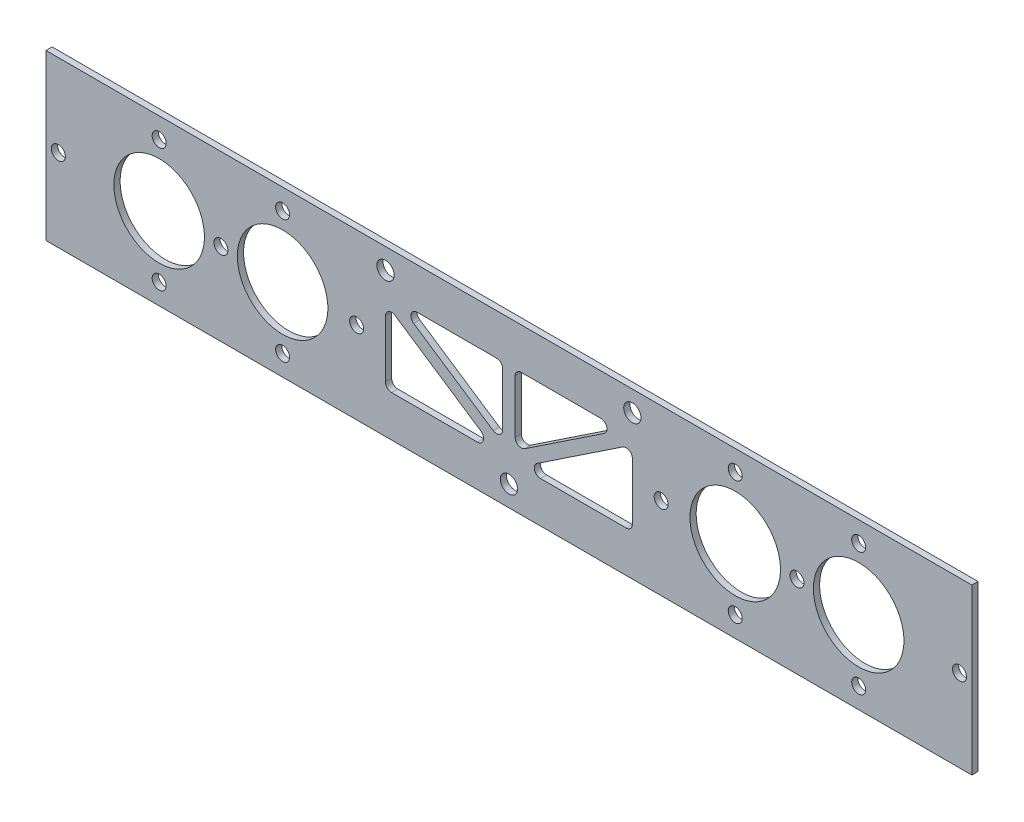
from build123d import *

# Parameters (mm, degrees)
SKETCH_1_W          = 225
SKETCH_1_H          = 40
EXTRUDE_1_DEPTH     = 1.5
SKETCH_2_R          = 11
SKETCH_2_R_2        = 2.1
CUT_EXTRUDE_1_DEPTH = 115.273794021
SKETCH_3_R          = 11
SKETCH_3_R_2        = 2.1
SKETCH_3_R_3        = 1.7
CUT_EXTRUDE_2_DEPTH = 115.273794021


with BuildPart() as part:
    # 草图1 → 凸台-拉伸1 (new body)
    with BuildSketch(Plane.XY):
        Rectangle(SKETCH_1_W, SKETCH_1_H)
    extrude(amount=EXTRUDE_1_DEPTH)

    # 草图2 → 切除-拉伸1 (cut, through all)
    with BuildSketch(Plane(origin=(0, 0, 0), x_dir=(-1, 0, 0), z_dir=(0, 0, -1))):
        with Locations((85, 0)):
            Circle(SKETCH_2_R)
        with Locations((55, 0)):
            Circle(SKETCH_2_R)
        with Locations((30, 15)):
            Circle(SKETCH_2_R_2)
        with Locations((0, -15)):
            Circle(SKETCH_2_R_2)
        with Locations((-30, 15)):
            Circle(SKETCH_2_R_2)
        with Locations((-85, 0)):
            Circle(SKETCH_2_R)
        with Locations((-55, 0)):
            Circle(SKETCH_2_R)
        with BuildLine():
            Line((-6.826276619, -7.251924558), (-27.667949706, 6.642524166))
            ThreePointArc((-27.667949706, 6.642524166), (-29.207786888, 6.716960623), (-30, 5.394448725))
            Line((-30, 5.394448725), (-30, -8.5))
            ThreePointArc((-30, -8.5), (-29.560660172, -9.560660172), (-28.5, -10))
            Line((-28.5, -10), (-7.658326913, -10))
            ThreePointArc((-7.658326913, -10), (-6.222688873, -8.934676223), (-6.826276619, -7.251924558))
        make_face()
        with BuildLine():
            Line((-1.5, -4.394448725), (-1.5, 8.5))
            ThreePointArc((-1.5, 8.5), (-1.939339828, 9.560660172), (-3, 10))
            Line((-3, 10), (-22.341673087, 10))
            ThreePointArc((-22.341673087, 10), (-23.777311127, 8.934676223), (-23.173723381, 7.251924558))
            Line((-23.173723381, 7.251924558), (-3.832050294, -5.642524166))
            ThreePointArc((-3.832050294, -5.642524166), (-2.292213112, -5.716960623), (-1.5, -4.394448725))
        make_face()
        with BuildLine():
            Line((3.832050294, -5.642524166), (23.173723381, 7.251924558))
            ThreePointArc((23.173723381, 7.251924558), (23.777311127, 8.934676223), (22.341673087, 10))
            Line((22.341673087, 10), (3, 10))
            ThreePointArc((3, 10), (1.939339828, 9.560660172), (1.5, 8.5))
            Line((1.5, 8.5), (1.5, -4.394448725))
            ThreePointArc((1.5, -4.394448725), (2.292213112, -5.716960623), (3.832050294, -5.642524166))
        make_face()
        with BuildLine():
            Line((30, -8.5), (30, 5.394448725))
            ThreePointArc((30, 5.394448725), (29.207786888, 6.716960623), (27.667949706, 6.642524166))
            Line((27.667949706, 6.642524166), (6.826276619, -7.251924558))
            ThreePointArc((6.826276619, -7.251924558), (6.222688873, -8.934676223), (7.658326913, -10))
            Line((7.658326913, -10), (28.5, -10))
            ThreePointArc((28.5, -10), (29.560660172, -9.560660172), (30, -8.5))
        make_face()
    extrude(amount=-CUT_EXTRUDE_1_DEPTH, mode=Mode.SUBTRACT)

    # 草图3 → 切除-拉伸2 (cut, through all)
    with BuildSketch(Plane(origin=(0, 0, 0), x_dir=(-1, 0, 0), z_dir=(0, 0, -1))):
        with Locations((85, 0)):
            Circle(SKETCH_3_R)
        with Locations((55, 0)):
            Circle(SKETCH_3_R)
        with Locations((0, -15)):
            Circle(SKETCH_3_R_2)
        with Locations((-55, 0)):
            Circle(SKETCH_3_R)
        with Locations((30, 15)):
            Circle(SKETCH_3_R_2)
        with Locations((-30, 15)):
            Circle(SKETCH_3_R_2)
        with Locations((-85, 0)):
            Circle(SKETCH_3_R)
        with Locations((55, -15)):
            Circle(SKETCH_3_R_3)
        with Locations((85, -15)):
            Circle(SKETCH_3_R_3)
        with Locations((-37, 0)):
            Circle(SKETCH_3_R_3)
        with Locations((37, 0)):
            Circle(SKETCH_3_R_3)
        with Locations((70, 0)):
            Circle(SKETCH_3_R_3)
        with Locations((-109.5, 0)):
            Circle(SKETCH_3_R_3)
        with Locations((-85, -15)):
            Circle(SKETCH_3_R_3)
        with Locations((109.5, 0)):
            Circle(SKETCH_3_R_3)
        with Locations((-70, 0)):
            Circle(SKETCH_3_R_3)
        with Locations((-55, 15)):
            Circle(SKETCH_3_R_3)
        with Locations((85, 15)):
            Circle(SKETCH_3_R_3)
        with Locations((-85, 15)):
            Circle(SKETCH_3_R_3)
        with Locations((-55, -15)):
            Circle(SKETCH_3_R_3)
        with Locations((55, 15)):
            Circle(SKETCH_3_R_3)
        with BuildLine():
            Line((-23.173723381, 7.251924558), (-3.832050294, -5.642524166))
            ThreePointArc((-3.832050294, -5.642524166), (-2.292213112, -5.716960623), (-1.5, -4.394448725))
            Line((-1.5, -4.394448725), (-1.5, 8.5))
            ThreePointArc((-1.5, 8.5), (-1.939339828, 9.560660172), (-3, 10))
            Line((-3, 10), (-22.341673087, 10))
            ThreePointArc((-22.341673087, 10), (-23.777311127, 8.934676223), (-23.173723381, 7.251924558))
        make_face()
        with BuildLine():
            Line((-30, 5.394448725), (-30, -8.5))
            ThreePointArc((-30, -8.5), (-29.560660172, -9.560660172), (-28.5, -10))
            Line((-28.5, -10), (-7.658326913, -10))
            ThreePointArc((-7.658326913, -10), (-6.222688873, -8.934676223), (-6.826276619, -7.251924558))
            Line((-6.826276619, -7.251924558), (-27.667949706, 6.642524166))
            ThreePointArc((-27.667949706, 6.642524166), (-29.207786888, 6.716960623), (-30, 5.394448725))
        make_face()
        with BuildLine():
            Line((27.667949706, 6.642524166), (6.826276619, -7.251924558))
            ThreePointArc((6.826276619, -7.251924558), (6.222688873, -8.934676223), (7.658326913, -10))
            Line((7.658326913, -10), (28.5, -10))
            ThreePointArc((28.5, -10), (29.560660172, -9.560660172), (30, -8.5))
            Line((30, -8.5), (30, 5.394448725))
            ThreePointArc((30, 5.394448725), (29.207786888, 6.716960623), (27.667949706, 6.642524166))
        make_face()
        with BuildLine():
            Line((1.5, 8.5), (1.5, -4.394448725))
            ThreePointArc((1.5, -4.394448725), (2.292213112, -5.716960623), (3.832050294, -5.642524166))
            Line((3.832050294, -5.642524166), (23.173723381, 7.251924558))
            ThreePointArc((23.173723381, 7.251924558), (23.777311127, 8.934676223), (22.341673087, 10))
            Line((22.341673087, 10), (3, 10))
            ThreePointArc((3, 10), (1.939339828, 9.560660172), (1.5, 8.5))
        make_face()
    extrude(amount=-CUT_EXTRUDE_2_DEPTH, mode=Mode.SUBTRACT)


solid = part.part
